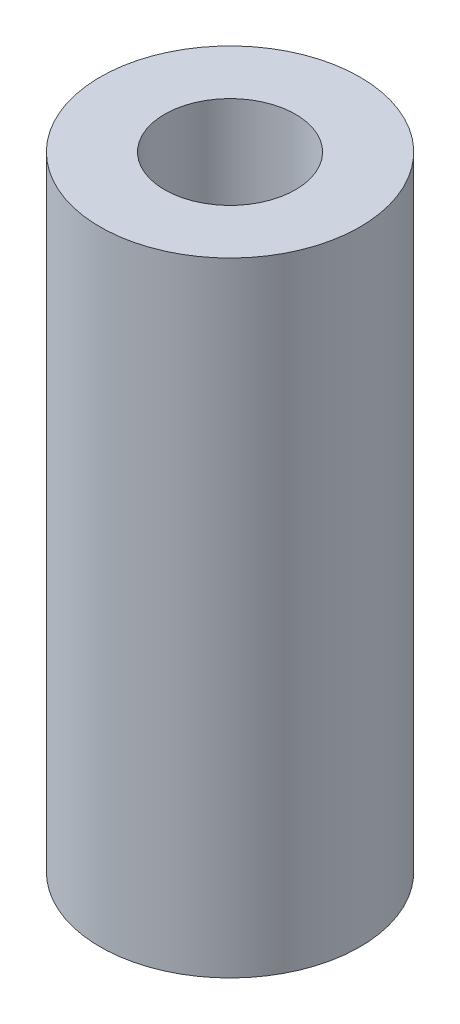
from build123d import *

# Parameters (mm, degrees)
SKETCH2_R           = 15.875
BOSS_EXTRUDE1_DEPTH = 38.1
HOLE1_D             = 16.002


with BuildPart() as part:
    # Sketch2 → Boss-Extrude1 (new, symmetric)
    with BuildSketch(Plane(origin=(0, 0, 0), x_dir=(1, 0, 0), z_dir=(0, 1, 0))):
        with Locations(Location((0, 0, 0), (0, 0, 90))):
            Circle(SKETCH2_R)
    extrude(amount=BOSS_EXTRUDE1_DEPTH, both=True)

    # Hole1 (through all)
    with Locations(Plane(origin=(0, 38.1, 0), x_dir=(1, 0, 0), z_dir=(0, 1, 0))):
        with Locations((0, 0)):
            Hole(HOLE1_D / 2)


solid = part.part
